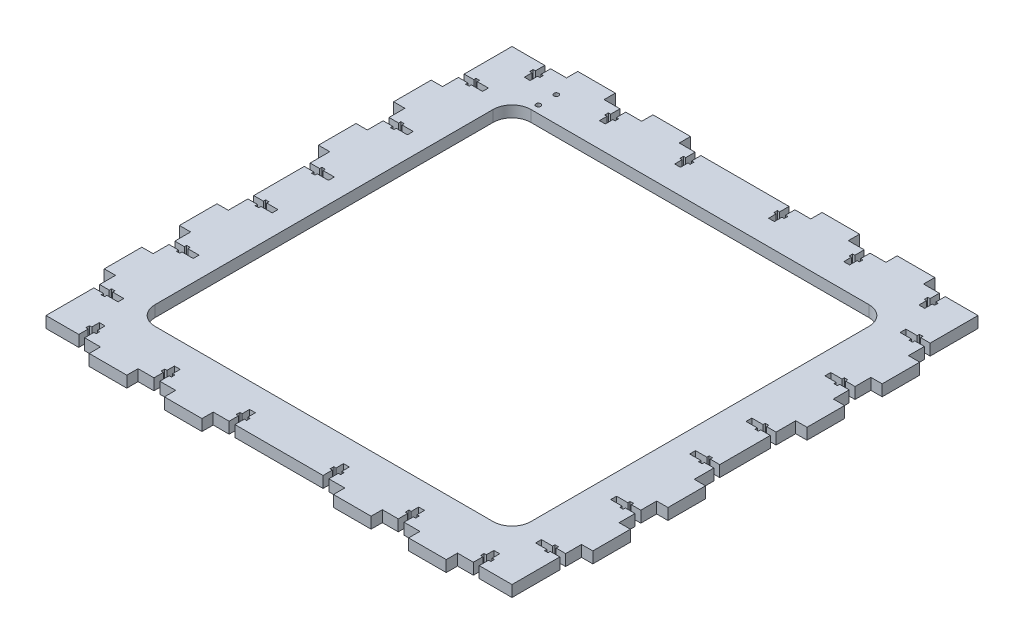
from build123d import *

# Parameters (mm, degrees)
BOSS_EXTRUDE1_DEPTH = 6
CUT_EXTRUDE1_DEPTH  = 10
CUT_EXTRUDE2_DEPTH  = 10
SKETCH4_W           = 200
SKETCH4_H           = 200
CUT_EXTRUDE3_DEPTH  = 10
FILLET1_R           = 10
SKETCH5_R           = 1.25
CUT_EXTRUDE5_DEPTH  = 10


with BuildPart() as part:
    # Sketch1 → Boss-Extrude1 (new body)
    with BuildSketch(Plane(origin=(0, 0, 0), x_dir=(1, 0, 0), z_dir=(0, 1, 0))):
        Polygon((35, 6), (35, 0), (55, 0), (55, 6), (75, 6), (75, 0), (95, 0), (95, 6), (165, 6), (165, 0), (185, 0), (185, 6), (205, 6), (205, 0), (225, 0), (225, 6), (254, 6), (254, 43), (260, 43), (260, 63), (254, 63), (254, 83), (260, 83), (260, 103), (254, 103), (254, 157), (260, 157), (260, 177), (254, 177), (254, 197), (260, 197), (260, 217), (254, 217), (254, 254), (225, 254), (225, 260), (205, 260), (205, 254), (185, 254), (185, 260), (165, 260), (165, 254), (95, 254), (95, 260), (75, 260), (75, 254), (55, 254), (55, 260), (35, 260), (35, 254), (6, 254), (6, 217), (0, 217), (0, 197), (6, 197), (6, 177), (0, 177), (0, 157), (6, 157), (6, 103), (0, 103), (0, 83), (6, 83), (6, 63), (0, 63), (0, 43), (6, 43), (6, 6), align=None)
    extrude(amount=BOSS_EXTRUDE1_DEPTH)

    # Sketch2 → Cut-Extrude1 (cut)
    with BuildSketch(Plane(origin=(0, 6, 0), x_dir=(1, 0, 0), z_dir=(0, 1, 0))):
        Polygon((23.45, 254), (26.55, 254), (26.55, 249), (27.75, 249), (27.75, 247.1), (26.55, 247.1), (26.55, 243.1), (23.45, 243.1), (23.45, 247.1), (22.25, 247.1), (22.25, 249), (23.45, 249), align=None)
        Polygon((103.45, 254), (106.55, 254), (106.55, 249), (107.75, 249), (107.75, 247.1), (106.55, 247.1), (106.55, 243.1), (103.45, 243.1), (103.45, 247.1), (102.25, 247.1), (102.25, 249), (103.45, 249), align=None)
        Polygon((63.45, 247.1), (63.45, 243.1), (66.55, 243.1), (66.55, 247.1), (67.75, 247.1), (67.75, 249), (66.55, 249), (66.55, 254), (63.45, 254), (63.45, 249), (62.25, 249), (62.25, 247.1), align=None)
        Polygon((153.45, 247.1), (153.45, 243.1), (156.55, 243.1), (156.55, 247.1), (157.75, 247.1), (157.75, 249), (156.55, 249), (156.55, 254), (153.45, 254), (153.45, 249), (152.25, 249), (152.25, 247.1), align=None)
        Polygon((193.45, 254), (196.55, 254), (196.55, 249), (197.75, 249), (197.75, 247.1), (196.55, 247.1), (196.55, 243.1), (193.45, 243.1), (193.45, 247.1), (192.25, 247.1), (192.25, 249), (193.45, 249), align=None)
        Polygon((233.45, 247.1), (233.45, 243.1), (236.55, 243.1), (236.55, 247.1), (237.75, 247.1), (237.75, 249), (236.55, 249), (236.55, 254), (233.45, 254), (233.45, 249), (232.25, 249), (232.25, 247.1), align=None)
        Polygon((236.55, 6), (233.45, 6), (233.45, 11), (232.25, 11), (232.25, 12.9), (233.45, 12.9), (233.45, 16.9), (236.55, 16.9), (236.55, 12.9), (237.75, 12.9), (237.75, 11), (236.55, 11), align=None)
        Polygon((156.55, 6), (153.45, 6), (153.45, 11), (152.25, 11), (152.25, 12.9), (153.45, 12.9), (153.45, 16.9), (156.55, 16.9), (156.55, 12.9), (157.75, 12.9), (157.75, 11), (156.55, 11), align=None)
        Polygon((196.55, 12.9), (196.55, 16.9), (193.45, 16.9), (193.45, 12.9), (192.25, 12.9), (192.25, 11), (193.45, 11), (193.45, 6), (196.55, 6), (196.55, 11), (197.75, 11), (197.75, 12.9), align=None)
        Polygon((106.55, 12.9), (106.55, 16.9), (103.45, 16.9), (103.45, 12.9), (102.25, 12.9), (102.25, 11), (103.45, 11), (103.45, 6), (106.55, 6), (106.55, 11), (107.75, 11), (107.75, 12.9), align=None)
        Polygon((66.55, 6), (63.45, 6), (63.45, 11), (62.25, 11), (62.25, 12.9), (63.45, 12.9), (63.45, 16.9), (66.55, 16.9), (66.55, 12.9), (67.75, 12.9), (67.75, 11), (66.55, 11), align=None)
        Polygon((26.55, 12.9), (26.55, 16.9), (23.45, 16.9), (23.45, 12.9), (22.25, 12.9), (22.25, 11), (23.45, 11), (23.45, 6), (26.55, 6), (26.55, 11), (27.75, 11), (27.75, 12.9), align=None)
    extrude(amount=-CUT_EXTRUDE1_DEPTH, mode=Mode.SUBTRACT)

    # Sketch3 → Cut-Extrude2 (cut)
    with BuildSketch(Plane(origin=(0, 6, 0), x_dir=(1, 0, 0), z_dir=(0, 1, 0))):
        Polygon((6, 228.55), (11.1, 228.55), (11.1, 229.75), (12.9, 229.75), (12.9, 228.55), (18.9, 228.55), (18.9, 225.45), (12.9, 225.45), (12.9, 224.25), (11.1, 224.25), (11.1, 225.45), (6, 225.45), align=None)
        Polygon((12.9, 188.55), (18.9, 188.55), (18.9, 185.45), (12.9, 185.45), (12.9, 184.25), (11.1, 184.25), (11.1, 185.45), (6, 185.45), (6, 188.55), (11.1, 188.55), (11.1, 189.75), (12.9, 189.75), align=None)
        Polygon((6, 146.55), (11.1, 146.55), (11.1, 147.75), (12.9, 147.75), (12.9, 146.55), (18.9, 146.55), (18.9, 143.45), (12.9, 143.45), (12.9, 142.25), (11.1, 142.25), (11.1, 143.45), (6, 143.45), align=None)
        Polygon((12.9, 116.55), (18.9, 116.55), (18.9, 113.45), (12.9, 113.45), (12.9, 112.25), (11.1, 112.25), (11.1, 113.45), (6, 113.45), (6, 116.55), (11.1, 116.55), (11.1, 117.75), (12.9, 117.75), align=None)
        Polygon((6, 74.55), (11.1, 74.55), (11.1, 75.75), (12.9, 75.75), (12.9, 74.55), (18.9, 74.55), (18.9, 71.45), (12.9, 71.45), (12.9, 70.25), (11.1, 70.25), (11.1, 71.45), (6, 71.45), align=None)
        Polygon((12.9, 34.55), (18.9, 34.55), (18.9, 31.45), (12.9, 31.45), (12.9, 30.25), (11.1, 30.25), (11.1, 31.45), (6, 31.45), (6, 34.55), (11.1, 34.55), (11.1, 35.75), (12.9, 35.75), align=None)
        Polygon((254, 31.45), (248.9, 31.45), (248.9, 30.25), (247.1, 30.25), (247.1, 31.45), (241.1, 31.45), (241.1, 34.55), (247.1, 34.55), (247.1, 35.75), (248.9, 35.75), (248.9, 34.55), (254, 34.55), align=None)
        Polygon((247.1, 71.45), (241.1, 71.45), (241.1, 74.55), (247.1, 74.55), (247.1, 75.75), (248.9, 75.75), (248.9, 74.55), (254, 74.55), (254, 71.45), (248.9, 71.45), (248.9, 70.25), (247.1, 70.25), align=None)
        Polygon((254, 113.45), (248.9, 113.45), (248.9, 112.25), (247.1, 112.25), (247.1, 113.45), (241.1, 113.45), (241.1, 116.55), (247.1, 116.55), (247.1, 117.75), (248.9, 117.75), (248.9, 116.55), (254, 116.55), align=None)
        Polygon((247.1, 143.45), (241.1, 143.45), (241.1, 146.55), (247.1, 146.55), (247.1, 147.75), (248.9, 147.75), (248.9, 146.55), (254, 146.55), (254, 143.45), (248.9, 143.45), (248.9, 142.25), (247.1, 142.25), align=None)
        Polygon((254, 185.45), (248.9, 185.45), (248.9, 184.25), (247.1, 184.25), (247.1, 185.45), (241.1, 185.45), (241.1, 188.55), (247.1, 188.55), (247.1, 189.75), (248.9, 189.75), (248.9, 188.55), (254, 188.55), align=None)
        Polygon((247.1, 225.45), (241.1, 225.45), (241.1, 228.55), (247.1, 228.55), (247.1, 229.75), (248.9, 229.75), (248.9, 228.55), (254, 228.55), (254, 225.45), (248.9, 225.45), (248.9, 224.25), (247.1, 224.25), align=None)
    extrude(amount=-CUT_EXTRUDE2_DEPTH, mode=Mode.SUBTRACT)

    # Sketch4 → Cut-Extrude3 (cut)
    with BuildSketch(Plane(origin=(0, 6, 0), x_dir=(1, 0, 0), z_dir=(0, 1, 0))):
        with Locations((130, 130)):
            Rectangle(SKETCH4_W, SKETCH4_H)
    extrude(amount=-CUT_EXTRUDE3_DEPTH, mode=Mode.SUBTRACT)

    # Fillet1
    fillet1_edges = [part.edges().sort_by_distance(p)[0] for p in [
        (30, 3, -230),
        (230, 3, -230),
        (230, 3, -30),
        (30, 3, -30),
    ]]
    fillet(fillet1_edges, radius=FILLET1_R)

    # Sketch5 → Cut-Extrude5 (cut)
    with BuildSketch(Plane(origin=(0, 6, 0), x_dir=(1, 0, 0), z_dir=(0, 1, 0))):
        with Locations(Location((40, 234, 0), (0, 0, 270))):
            Circle(SKETCH5_R)
        with Locations(Location((40, 243.6, 0), (0, 0, 270))):
            Circle(SKETCH5_R)
    extrude(amount=-CUT_EXTRUDE5_DEPTH, mode=Mode.SUBTRACT)


solid = part.part
